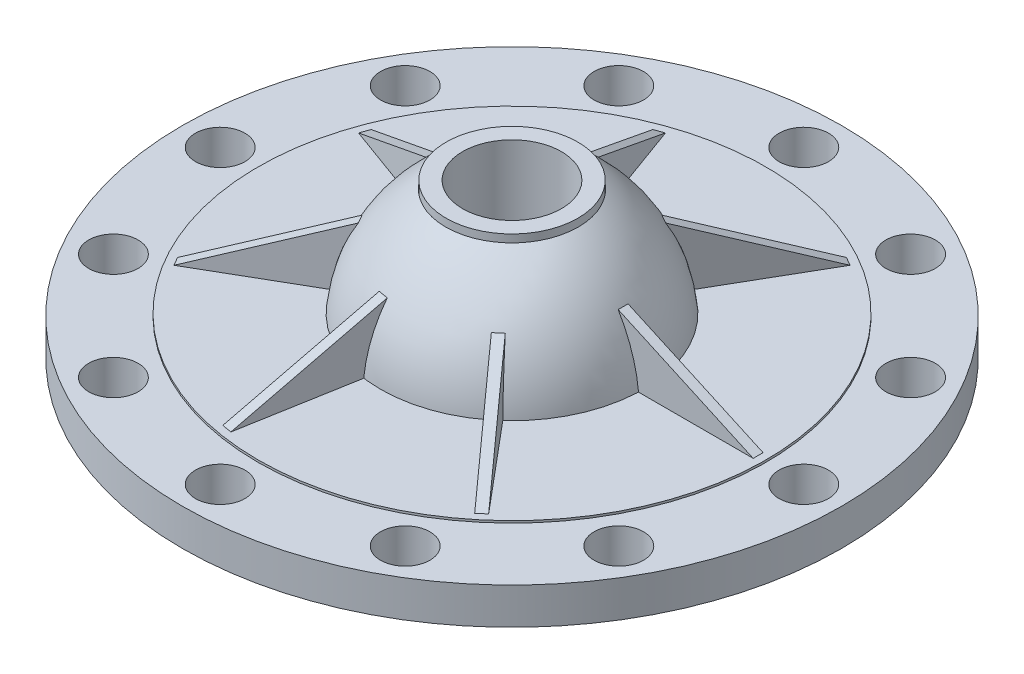
from build123d import *

# Parameters (mm, degrees)
CUT_EXTRUDE2_DEPTH      = 17
CUT_EXTRUDE2_DEPTH_BACK = 59
SKETCH6_R               = 20.095141551
BODY_MOVE_COPY4_ANGLE   = 180
SKETCH7_R               = 100
SKETCH7_R_2             = 39.142219113
BOSS_EXTRUDE1_DEPTH     = 11.097638053
SKETCH8_R               = 77
BOSS_EXTRUDE2_DEPTH     = 6
BOSS_EXTRUDE13_DEPTH    = 1.5
CIRPATTERN5_COUNT       = 7
CIRPATTERN5_ANGLE       = 300
CUT_EXTRUDE5_DEPTH      = 147.634210368
CUT_EXTRUDE5_DEPTH_BACK = 147.634210368
SKETCH17_R              = 7.5
SKETCH18_R              = 20
SKETCH18_R_2            = 15
EXTRUDE_THIN1_DEPTH     = 35


with BuildPart() as part:
    # Sketch3 → Revolve1 (revolve)
    with BuildSketch(Plane.XY):
        with BuildLine():
            Line((0, 0), (-40.047023048, 0))
            ThreePointArc((-40.047023048, 0), (-29.14156029, 30.853474157), (0, 45.74090004))
            Line((0, 45.74090004), (0, 0))
        make_face()
    revolve(axis=Axis((0, 0, 0), (0, 1, 0)))

    # Sketch6 → Cut-Extrude2 (cut, two sides: drawn at the far end of the back side and taken through both)
    with BuildSketch(Plane(origin=(0, 40.217392268, 0), x_dir=(1, 0, 0), z_dir=(0, 1, 0)).offset(-CUT_EXTRUDE2_DEPTH_BACK)):
        Circle(SKETCH6_R)
    extrude(amount=CUT_EXTRUDE2_DEPTH + CUT_EXTRUDE2_DEPTH_BACK, mode=Mode.SUBTRACT)


with BuildPart() as body_2:
    # Body-Move/Copy2: copy of part
    add(part.part.moved(Location((0, -37.86336033, 0))))


with BuildPart() as body_2_1:
    # Body-Move/Copy4: moved
    add(body_2.part.rotate(Axis((0, -18.50454008, 0), (0, 0, 1)), BODY_MOVE_COPY4_ANGLE))


with BuildPart() as body_2_2:
    # Body-Move/Copy5: moved
    add(body_2_1.part.moved(Location((0, -0.887015699, 0))))



with BuildPart() as body_3:
    # Sketch7 → Boss-Extrude1 (new body)
    with BuildSketch(Plane(origin=(0, 0, 0), x_dir=(1, 0, 0), z_dir=(0, 1, 0))):
        Circle(SKETCH7_R)
        Circle(SKETCH7_R_2, mode=Mode.SUBTRACT)
    extrude(amount=BOSS_EXTRUDE1_DEPTH)


with BuildPart() as body_3_1:
    # Body-Move/Copy6: moved
    add(body_3.part.moved(Location((0, -5.748924731, 0))))


with BuildPart() as part_1:
    add(part.part)

    add(body_3_1.part)  # Boss-Extrude2 merges body 3
    # Sketch8 → Boss-Extrude2 (add)
    with BuildSketch(Plane(origin=(0, 0, 0), x_dir=(1, 0, 0), z_dir=(0, 1, 0))):
        Circle(SKETCH8_R)
    extrude(amount=BOSS_EXTRUDE2_DEPTH)

    # Sketch17 → Cut-Extrude5 (cut, two sides: drawn at the far end of the back side and taken through both)
    with BuildSketch(Plane(origin=(0, 0, 0), x_dir=(1, 0, 0), z_dir=(0, 1, 0)).offset(-CUT_EXTRUDE5_DEPTH_BACK)):
        with Locations((0, 88.5)):
            Circle(SKETCH17_R)
        with Locations((44.25, 76.643248235)):
            Circle(SKETCH17_R)
        with Locations((76.643248235, 44.25)):
            Circle(SKETCH17_R)
        with Locations((88.5, 0)):
            Circle(SKETCH17_R)
        with Locations((76.643248235, -44.25)):
            Circle(SKETCH17_R)
        with Locations((44.25, -76.643248235)):
            Circle(SKETCH17_R)
        with Locations((0, -88.5)):
            Circle(SKETCH17_R)
        with Locations((-44.25, -76.643248235)):
            Circle(SKETCH17_R)
        with Locations((-76.643248235, -44.25)):
            Circle(SKETCH17_R)
        with Locations((-88.5, 0)):
            Circle(SKETCH17_R)
        with Locations((-76.643248235, 44.25)):
            Circle(SKETCH17_R)
        with Locations((-44.25, 76.643248235)):
            Circle(SKETCH17_R)
    extrude(amount=CUT_EXTRUDE5_DEPTH + CUT_EXTRUDE5_DEPTH_BACK, mode=Mode.SUBTRACT)


with BuildPart() as body_3_2:
    # Sketch16 → Boss-Extrude13 (new, symmetric)
    with BuildSketch(Plane.XY):
        with BuildLine():
            Line((33.708253694, 24.60937975), (74.657585406, 6))
            Line((74.657585406, 6), (39.87678909, 6))
            ThreePointArc((39.87678909, 6), (37.837758212, 15.651159258), (33.708253694, 24.60937975))
        make_face()
    extrude(amount=BOSS_EXTRUDE13_DEPTH, both=True)


with BuildPart() as cirpattern5_1:
    # CirPattern5: pattern copy
    add(body_3_2.part.rotate(Axis((0, 42.591041327, 0), (0, -1, 0)), 1 * CIRPATTERN5_ANGLE / (CIRPATTERN5_COUNT - 1)))


with BuildPart() as cirpattern5_2:
    # CirPattern5: pattern copy
    add(body_3_2.part.rotate(Axis((0, 42.591041327, 0), (0, -1, 0)), 2 * CIRPATTERN5_ANGLE / (CIRPATTERN5_COUNT - 1)))


with BuildPart() as cirpattern5_3:
    # CirPattern5: pattern copy
    add(body_3_2.part.rotate(Axis((0, 42.591041327, 0), (0, -1, 0)), 3 * CIRPATTERN5_ANGLE / (CIRPATTERN5_COUNT - 1)))


with BuildPart() as cirpattern5_4:
    # CirPattern5: pattern copy
    add(body_3_2.part.rotate(Axis((0, 42.591041327, 0), (0, -1, 0)), 4 * CIRPATTERN5_ANGLE / (CIRPATTERN5_COUNT - 1)))


with BuildPart() as cirpattern5_5:
    # CirPattern5: pattern copy
    add(body_3_2.part.rotate(Axis((0, 42.591041327, 0), (0, -1, 0)), 5 * CIRPATTERN5_ANGLE / (CIRPATTERN5_COUNT - 1)))


with BuildPart() as cirpattern5_6:
    # CirPattern5: pattern copy
    add(body_3_2.part.rotate(Axis((0, 42.591041327, 0), (0, -1, 0)), 6 * CIRPATTERN5_ANGLE / (CIRPATTERN5_COUNT - 1)))


with BuildPart() as body_2_3:
    add(body_2_2.part)

    add(part_1.part)  # Extrude-Thin1 merges part
    # Sketch18 → Extrude-Thin1 (add, symmetric)
    with BuildSketch(Plane(origin=(0, 6, 0), x_dir=(1, 0, 0), z_dir=(0, 1, 0))):
        Circle(SKETCH18_R)
        Circle(SKETCH18_R_2, mode=Mode.SUBTRACT)
    extrude(amount=EXTRUDE_THIN1_DEPTH, both=True)


solid = Compound([body_3_2.part, cirpattern5_1.part, cirpattern5_2.part, cirpattern5_3.part, cirpattern5_4.part, cirpattern5_5.part, cirpattern5_6.part, body_2_3.part])
